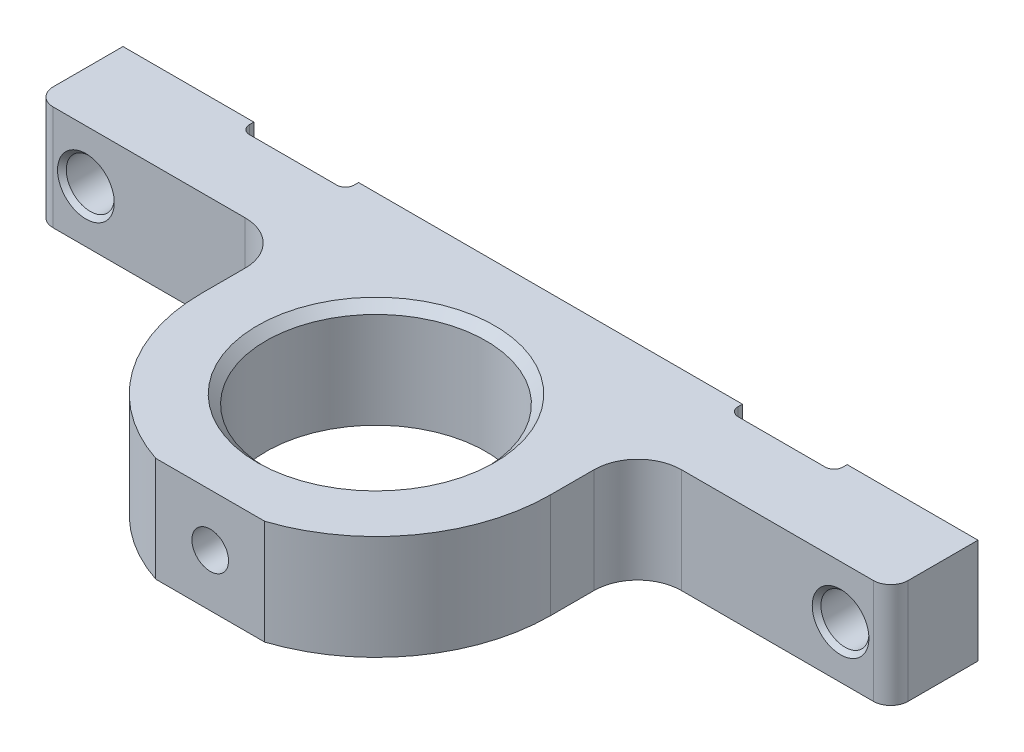
from build123d import *

# Parameters (mm, degrees)
SKETCH1_R                  = 12.6
BOSS_EXTRUDE1_DEPTH        = 12
FILLET1_R                  = 5
FILLET2_R                  = 2
F_5_5_5_5_DIAMETER_HOLE1_D = 5.5
FILLET3_R                  = 1
M5_TAPPED_HOLE1_REACH      = 65.765
M5_TAPPED_HOLE1_BORE_R     = 2.1
CHAMFER1_SIZE              = 0.5
CHAMFER2_SIZE              = 1


with BuildPart() as part:
    # Sketch1 → Boss-Extrude1 (new body)
    with BuildSketch(Plane(origin=(0, 0, 0), x_dir=(1, 0, 0), z_dir=(0, 1, 0))):
        with BuildLine():
            Line((-49, 20), (-34, 20))
            Line((-34, 20), (-34, 18.5))
            Line((-34, 18.5), (-22, 18.5))
            Line((-22, 18.5), (-22, 20))
            Line((-22, 20), (22, 20))
            Line((22, 20), (22, 18.5))
            Line((22, 18.5), (34, 18.5))
            Line((34, 18.5), (34, 20))
            Line((34, 20), (49, 20))
            Line((49, 20), (49, 10))
            Line((49, 10), (20, 10))
            Line((20, 10), (20, 0))
            ThreePointArc((20, 0), (16.200308021, -11.728172066), (6.244997998, -19))
            Line((6.244997998, -19), (-6.244997998, -19))
            ThreePointArc((-6.244997998, -19), (-16.200308021, -11.728172066), (-20, 0))
            Line((-20, 0), (-20, 10))
            Line((-20, 10), (-49, 10))
            Line((-49, 10), (-49, 20))
        make_face()
        with Locations(Location((0, 0, 0), (0, 0, 270))):
            Circle(SKETCH1_R, mode=Mode.SUBTRACT)
    extrude(amount=BOSS_EXTRUDE1_DEPTH)

    # Fillet1
    fillet1_edges = [part.edges().sort_by_distance(p)[0] for p in [
        (20, 6, -10),
        (-20, 6, -10),
    ]]
    fillet(fillet1_edges, radius=FILLET1_R)

    # Fillet2
    fillet2_edges = [part.edges().sort_by_distance(p)[0] for p in [
        (49, 6, -10),
        (-49, 6, -10),
    ]]
    fillet(fillet2_edges, radius=FILLET2_R)

    # Ø5.5 (5.5) Diameter Hole1 (through all)
    with Locations(Plane.XY.offset(-10)):
        with Locations((-43.25, 6), (43.25, 6)):
            Hole(F_5_5_5_5_DIAMETER_HOLE1_D / 2)

    # Fillet3
    fillet3_edges = [part.edges().sort_by_distance(p)[0] for p in [
        (-34, 6, -18.5),
        (-22, 6, -18.5),
        (22, 6, -18.5),
        (34, 6, -18.5),
    ]]
    fillet(fillet3_edges, radius=FILLET3_R)

    # M5 Tapped Hole1 bore → M5 Tapped Hole1 (cut, up to next)
    with BuildSketch(Plane.XY.offset(19), mode=Mode.PRIVATE) as m5_tapped_hole1_sk1:
        with Locations((0, 6)):
            Circle(M5_TAPPED_HOLE1_BORE_R)
    m5_tapped_hole1_tool1 = extrude(m5_tapped_hole1_sk1.sketch, amount=-M5_TAPPED_HOLE1_REACH, mode=Mode.PRIVATE) & part.part
    add(m5_tapped_hole1_tool1.solids().sort_by_distance((0, 6, 19))[0], mode=Mode.SUBTRACT)

    # Chamfer1
    chamfer1_edges = [part.edges().sort_by_distance(p)[0] for p in [
        (46, 6, -10),
        (-40.5, 6, -10),
    ]]
    chamfer(chamfer1_edges, length=CHAMFER1_SIZE)

    # Chamfer2
    chamfer2_edges = [part.edges().sort_by_distance(p)[0] for p in [
        (0, 12, -12.6),
    ]]
    chamfer(chamfer2_edges, length=CHAMFER2_SIZE)


solid = part.part
